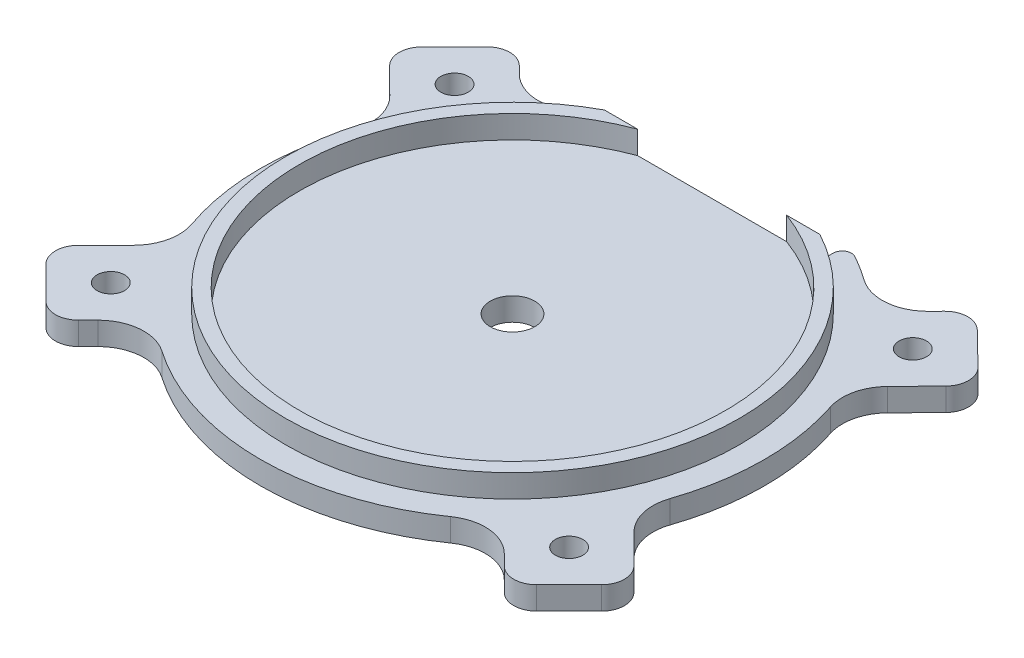
from build123d import *

# Parameters (mm, degrees)
SKETCH_1_R                  = 55
EXTRUDE_1_DEPTH             = 5
SKETCH_5_W                  = 47
SKETCH_5_H                  = 12.24289715
CUT_EXTRUDE_2_DEPTH         = 30
FILLET_4_R                  = 2
FILLET_5_R                  = 2
EXTRUDE_3_REACH             = 79.84
EXTRUDE_3_DIRECTION_2_REACH = 79.84
FILLET_7_R                  = 10
FILLET_8_R                  = 5
SKETCH_10_R                 = 3
CUT_EXTRUDE_5_DEPTH         = 5
SKETCH_15_R                 = 4.85
CUT_EXTRUDE_6_DEPTH         = 10
EXTRUDE_4_DEPTH             = 5


with BuildPart() as part:
    # 草图1 → 凸台-拉伸1 (new body)
    with BuildSketch(Plane(origin=(0, 0, 0), x_dir=(1, 0, 0), z_dir=(0, 1, 0))):
        with Locations(Location((0, 0, 0), (0, 0, 270))):
            Circle(SKETCH_1_R)
    extrude(amount=EXTRUDE_1_DEPTH)

    # 草图5 → 切除-拉伸2 (cut)
    with BuildSketch(Plane(origin=(0, 5, 0), x_dir=(1, 0, 0), z_dir=(0, 1, 0))):
        with Locations((0, 49.687490397)):
            Rectangle(SKETCH_5_W, SKETCH_5_H)
    extrude(amount=-CUT_EXTRUDE_2_DEPTH, mode=Mode.SUBTRACT)

    # 圆角4
    fillet_4_edges = [part.edges().sort_by_distance(p)[0] for p in [
        (-23.5, 2.5, -49.726753363),
    ]]
    fillet(fillet_4_edges, radius=FILLET_4_R)

    # 圆角5
    fillet_5_edges = [part.edges().sort_by_distance(p)[0] for p in [
        (23.5, 2.5, -49.726753363),
    ]]
    fillet(fillet_5_edges, radius=FILLET_5_R)

    # 凸台-拉伸3: up to this face of the body (flat: up to its plane)
    extrude_3_end = Plane(part.part.faces().sort_by_distance((0, 0, 2.477505486))[0])
    # 草图14 → 凸台-拉伸3 (add, up to the picked face)
    with BuildSketch(Plane(origin=(0, 3, 0), x_dir=(1, 0, 0), z_dir=(0, 1, 0)), mode=Mode.PRIVATE) as extrude_3_sk1:
        with BuildLine():
            Line((-49.898576095, 23.132922507), (-63.862525635, 37.044772973))
            Line((-63.862525635, 37.044772973), (-49.746845912, 51.213315099))
            Line((-49.746845912, 51.213315099), (-38.128637352, 39.638453724))
            ThreePointArc((-38.128637352, 39.638453724), (-44.78063998, 31.932652301), (-49.898576095, 23.132922507))
        make_face()
    extrude_3_tool1 = split(extrude(extrude_3_sk1.sketch, amount=-EXTRUDE_3_REACH, mode=Mode.PRIVATE), bisect_by=extrude_3_end, keep=Keep.BOTH, mode=Mode.PRIVATE)
    # 草图14 → 凸台-拉伸3 (add, up to the picked face)
    with BuildSketch(Plane(origin=(0, 3, 0), x_dir=(1, 0, 0), z_dir=(0, 1, 0)), mode=Mode.PRIVATE) as extrude_3_sk2:
        with BuildLine():
            Line((49.811900188, -23.3189751), (64.421720913, -37.928795825))
            Line((64.421720913, -37.928795825), (50.279585289, -52.070931449))
            Line((50.279585289, -52.070931449), (37.984884655, -39.776230814))
            ThreePointArc((37.984884655, -39.776230814), (44.662950793, -32.097053236), (49.811900188, -23.3189751))
        make_face()
    extrude_3_tool2 = split(extrude(extrude_3_sk2.sketch, amount=-EXTRUDE_3_REACH, mode=Mode.PRIVATE), bisect_by=extrude_3_end, keep=Keep.BOTH, mode=Mode.PRIVATE)
    # 草图14 → 凸台-拉伸3 (add, up to the picked face)
    with BuildSketch(Plane(origin=(0, 3, 0), x_dir=(1, 0, 0), z_dir=(0, 1, 0)), mode=Mode.PRIVATE) as extrude_3_sk3:
        with BuildLine():
            Line((-49.632393674, -23.698639164), (-63.862550335, -37.928795825))
            Line((-63.862550335, -37.928795825), (-49.720414711, -52.070931449))
            Line((-49.720414711, -52.070931449), (-37.697852746, -40.048369484))
            ThreePointArc((-37.697852746, -40.048369484), (-44.423770724, -32.427281642), (-49.632393674, -23.698639164))
        make_face()
    extrude_3_tool3 = split(extrude(extrude_3_sk3.sketch, amount=-EXTRUDE_3_REACH, mode=Mode.PRIVATE), bisect_by=extrude_3_end, keep=Keep.BOTH, mode=Mode.PRIVATE)
    # 草图14 → 凸台-拉伸3 (add, up to the picked face)
    with BuildSketch(Plane(origin=(0, 3, 0), x_dir=(1, 0, 0), z_dir=(0, 1, 0)), mode=Mode.PRIVATE) as extrude_3_sk4:
        with BuildLine():
            Line((38.475737251, 39.301623923), (50.118901666, 51.212426922))
            Line((50.118901666, 51.212426922), (64.420808036, 37.231887798))
            Line((64.420808036, 37.231887798), (50.134465219, 22.6171483))
            ThreePointArc((50.134465219, 22.6171483), (45.083643676, 31.50341367), (38.475737251, 39.301623923))
        make_face()
    extrude_3_tool4 = split(extrude(extrude_3_sk4.sketch, amount=-EXTRUDE_3_REACH, mode=Mode.PRIVATE), bisect_by=extrude_3_end, keep=Keep.BOTH, mode=Mode.PRIVATE)
    add(extrude_3_tool1.solids().sort_by(Axis((-50.837096, 3, -37.73966), (0, -1, 0)))[0])
    add(extrude_3_tool2.solids().sort_by(Axis((51.039653, 3, 38.272151), (0, -1, 0)))[0])
    add(extrude_3_tool3.solids().sort_by(Axis((-50.639154, 3, 38.439997), (0, -1, 0)))[0])
    add(extrude_3_tool4.solids().sort_by(Axis((51.238479, 3, -37.552164), (0, -1, 0)))[0])

    # 凸台-拉伸3 direction 2: up to this face of the body (flat: up to its plane)
    extrude_3_direction_2_end = Plane(part.part.faces().sort_by_distance((0, 5, 2.477505486))[0])
    # 草图14 → 凸台-拉伸3 direction 2 (add, up to the picked face)
    with BuildSketch(Plane(origin=(0, 3, 0), x_dir=(1, 0, 0), z_dir=(0, 1, 0)), mode=Mode.PRIVATE) as extrude_3_direction_2_sk1:
        with BuildLine():
            Line((-49.898576095, 23.132922507), (-63.862525635, 37.044772973))
            Line((-63.862525635, 37.044772973), (-49.746845912, 51.213315099))
            Line((-49.746845912, 51.213315099), (-38.128637352, 39.638453724))
            ThreePointArc((-38.128637352, 39.638453724), (-44.78063998, 31.932652301), (-49.898576095, 23.132922507))
        make_face()
    extrude_3_direction_2_tool1 = split(extrude(extrude_3_direction_2_sk1.sketch, amount=EXTRUDE_3_DIRECTION_2_REACH, mode=Mode.PRIVATE), bisect_by=extrude_3_direction_2_end, keep=Keep.BOTH, mode=Mode.PRIVATE)
    # 草图14 → 凸台-拉伸3 direction 2 (add, up to the picked face)
    with BuildSketch(Plane(origin=(0, 3, 0), x_dir=(1, 0, 0), z_dir=(0, 1, 0)), mode=Mode.PRIVATE) as extrude_3_direction_2_sk2:
        with BuildLine():
            Line((49.811900188, -23.3189751), (64.421720913, -37.928795825))
            Line((64.421720913, -37.928795825), (50.279585289, -52.070931449))
            Line((50.279585289, -52.070931449), (37.984884655, -39.776230814))
            ThreePointArc((37.984884655, -39.776230814), (44.662950793, -32.097053236), (49.811900188, -23.3189751))
        make_face()
    extrude_3_direction_2_tool2 = split(extrude(extrude_3_direction_2_sk2.sketch, amount=EXTRUDE_3_DIRECTION_2_REACH, mode=Mode.PRIVATE), bisect_by=extrude_3_direction_2_end, keep=Keep.BOTH, mode=Mode.PRIVATE)
    # 草图14 → 凸台-拉伸3 direction 2 (add, up to the picked face)
    with BuildSketch(Plane(origin=(0, 3, 0), x_dir=(1, 0, 0), z_dir=(0, 1, 0)), mode=Mode.PRIVATE) as extrude_3_direction_2_sk3:
        with BuildLine():
            Line((-49.632393674, -23.698639164), (-63.862550335, -37.928795825))
            Line((-63.862550335, -37.928795825), (-49.720414711, -52.070931449))
            Line((-49.720414711, -52.070931449), (-37.697852746, -40.048369484))
            ThreePointArc((-37.697852746, -40.048369484), (-44.423770724, -32.427281642), (-49.632393674, -23.698639164))
        make_face()
    extrude_3_direction_2_tool3 = split(extrude(extrude_3_direction_2_sk3.sketch, amount=EXTRUDE_3_DIRECTION_2_REACH, mode=Mode.PRIVATE), bisect_by=extrude_3_direction_2_end, keep=Keep.BOTH, mode=Mode.PRIVATE)
    # 草图14 → 凸台-拉伸3 direction 2 (add, up to the picked face)
    with BuildSketch(Plane(origin=(0, 3, 0), x_dir=(1, 0, 0), z_dir=(0, 1, 0)), mode=Mode.PRIVATE) as extrude_3_direction_2_sk4:
        with BuildLine():
            Line((38.475737251, 39.301623923), (50.118901666, 51.212426922))
            Line((50.118901666, 51.212426922), (64.420808036, 37.231887798))
            Line((64.420808036, 37.231887798), (50.134465219, 22.6171483))
            ThreePointArc((50.134465219, 22.6171483), (45.083643676, 31.50341367), (38.475737251, 39.301623923))
        make_face()
    extrude_3_direction_2_tool4 = split(extrude(extrude_3_direction_2_sk4.sketch, amount=EXTRUDE_3_DIRECTION_2_REACH, mode=Mode.PRIVATE), bisect_by=extrude_3_direction_2_end, keep=Keep.BOTH, mode=Mode.PRIVATE)
    add(extrude_3_direction_2_tool1.solids().sort_by(Axis((-50.837096, 3, -37.73966), (0, 1, 0)))[0])
    add(extrude_3_direction_2_tool2.solids().sort_by(Axis((51.039653, 3, 38.272151), (0, 1, 0)))[0])
    add(extrude_3_direction_2_tool3.solids().sort_by(Axis((-50.639154, 3, 38.439997), (0, 1, 0)))[0])
    add(extrude_3_direction_2_tool4.solids().sort_by(Axis((51.238479, 3, -37.552164), (0, 1, 0)))[0])

    # 圆角7
    fillet_7_edges = [part.edges().sort_by_distance(p)[0] for p in [
        (-38.128637352, 2.5, -39.638453724),
        (-49.898576095, 2.5, -23.132922507),
        (-49.632393674, 2.5, 23.698639164),
        (-37.697852746, 2.5, 40.048369484),
        (50.134465219, 2.5, -22.6171483),
        (38.475737251, 2.5, -39.301623923),
        (37.984884655, 2.5, 39.776230814),
        (49.811900188, 2.5, 23.3189751),
    ]]
    fillet(fillet_7_edges, radius=FILLET_7_R)

    # 圆角8
    fillet_8_edges = [part.edges().sort_by_distance(p)[0] for p in [
        (-63.862525635, 2.5, -37.044772973),
        (-49.746845912, 2.5, -51.213315099),
        (-49.720414711, 2.5, 52.070931449),
        (-63.862550335, 2.5, 37.928795825),
        (50.118901666, 2.5, -51.212426922),
        (64.420808036, 2.5, -37.231887798),
        (50.279585289, 2.5, 52.070931449),
        (64.421720913, 2.5, 37.928795825),
    ]]
    fillet(fillet_8_edges, radius=FILLET_8_R)

    # 草图10 → 切除-拉伸5 (cut, symmetric)
    with BuildSketch(Plane(origin=(0, 3, 0), x_dir=(1, 0, 0), z_dir=(0, 1, 0))):
        with Locations(Location((-49.720414711, 37.071204175, 0), (0, 0, 270))):
            Circle(SKETCH_10_R)
        with Locations(Location((50.279585289, 37.071204175, 0), (0, 0, 270))):
            Circle(SKETCH_10_R)
        with Locations(Location((-49.720414711, -37.928795825, 0), (0, 0, 270))):
            Circle(SKETCH_10_R)
        with Locations(Location((50.279585289, -37.928795825, 0), (0, 0, 270))):
            Circle(SKETCH_10_R)
    extrude(amount=CUT_EXTRUDE_5_DEPTH, both=True, mode=Mode.SUBTRACT)

    # 草图15 → 切除-拉伸6 (cut)
    with BuildSketch(Plane(origin=(0, 5, 0), x_dir=(1, 0, 0), z_dir=(0, 1, 0))):
        with Locations(Location((0, 0, 0), (0, 0, 270))):
            Circle(SKETCH_15_R)
    extrude(amount=-CUT_EXTRUDE_6_DEPTH, mode=Mode.SUBTRACT)

    # 草图17 → 凸台-拉伸4 (add)
    with BuildSketch(Plane(origin=(0, 5, 0), x_dir=(1, 0, 0), z_dir=(0, 1, 0))):
        with BuildLine():
            Line((-23.5, 43.566041822), (-16.255768207, 43.566041822))
            ThreePointArc((-16.255768207, 43.566041822), (0, -46.5), (16.255768207, 43.566041822))
            Line((16.255768207, 43.566041822), (23.5, 43.566041822))
            ThreePointArc((23.5, 43.566041822), (0, -49.5), (-23.5, 43.566041822))
        make_face()
    extrude(amount=EXTRUDE_4_DEPTH)


solid = part.part
